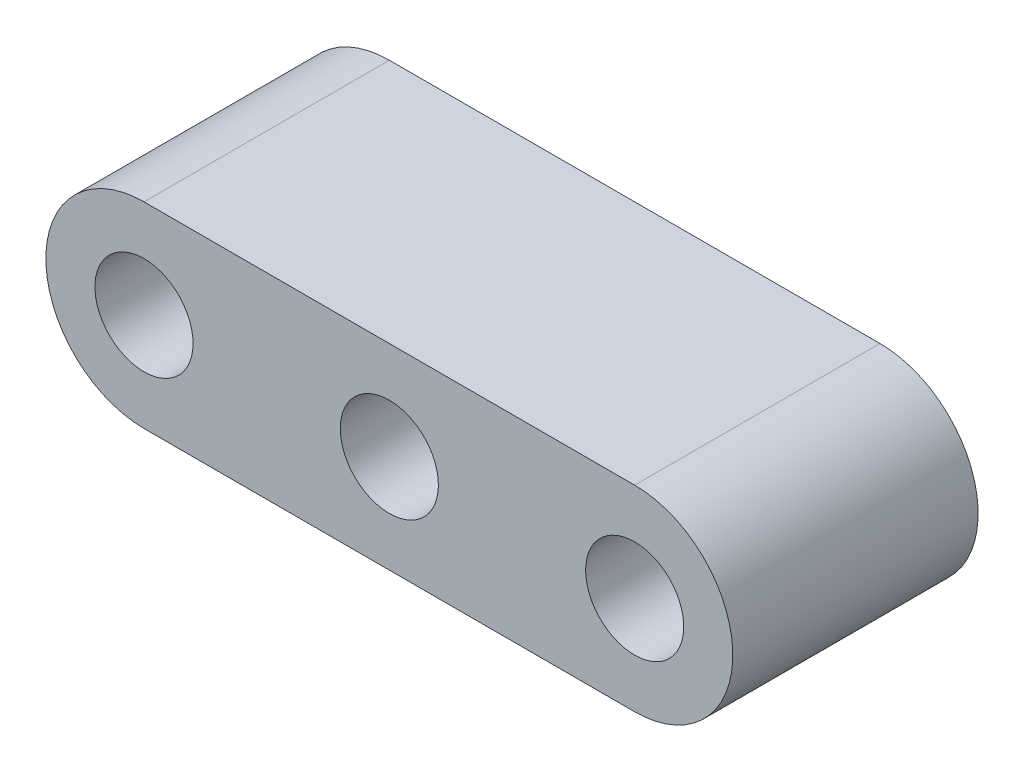
from build123d import *

# Parameters (mm, degrees)
SKETCH_1_R      = 2
EXTRUDE_1_DEPTH = 10


with BuildPart() as part:
    # 草图1 → 凸台-拉伸1 (new body)
    with BuildSketch(Plane.XY):
        with BuildLine():
            Line((-10, 4), (10, 4))
            ThreePointArc((10, 4), (14, 0), (10, -4))
            Line((10, -4), (-10, -4))
            ThreePointArc((-10, -4), (-14, 0), (-10, 4))
        make_face()
        with Locations((-10, 0)):
            Circle(SKETCH_1_R, mode=Mode.SUBTRACT)
        with Locations(Location((10, 0, 0), (0, 0, 180))):
            Circle(SKETCH_1_R, mode=Mode.SUBTRACT)
        Circle(SKETCH_1_R, mode=Mode.SUBTRACT)
    extrude(amount=EXTRUDE_1_DEPTH)


solid = part.part
